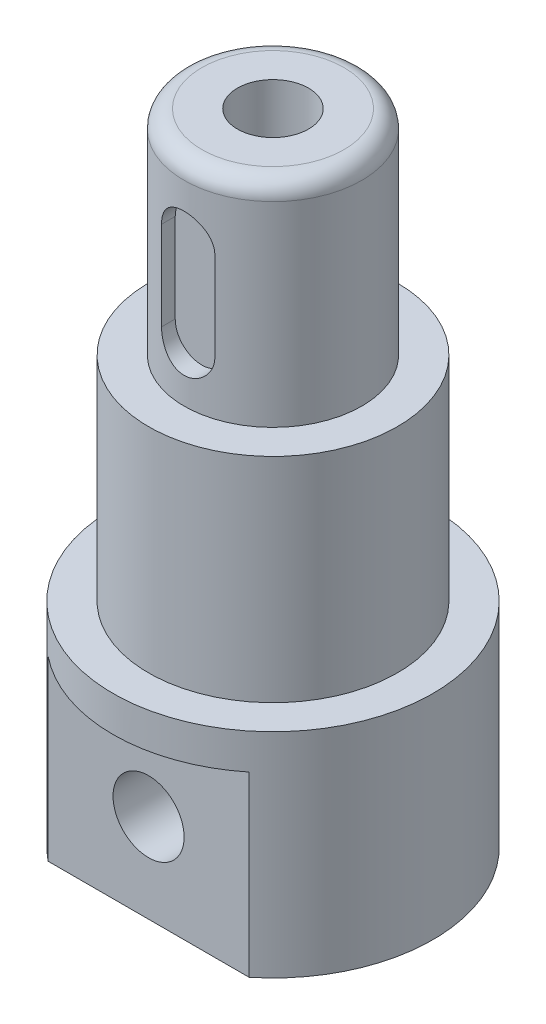
from build123d import *

# Parameters (mm, degrees)
CUT_EXTRUDE2_DEPTH      = 45.09081537
CUT_EXTRUDE2_DEPTH_BACK = 45.09081537
SKETCH2_R               = 4
CUT_EXTRUDE3_START      = -14
SKETCH2_4_W             = 30
SKETCH2_4_H             = 25.460379871
SKETCH2_4_R             = 4
CUT_EXTRUDE3_DEPTH      = 31.090815533
CUT_EXTRUDE4_START      = 14
SKETCH2_5_W             = 30
SKETCH2_5_H             = 25.460379871
SKETCH2_5_R             = 4
CUT_EXTRUDE4_DEPTH      = 31.090815533
CUT_EXTRUDE5_START      = -8
CUT_EXTRUDE5_DEPTH      = 10
CUT_EXTRUDE6_START      = 18
CUT_EXTRUDE6_DEPTH      = 10


with BuildPart() as part:
    # Sketch1 → Revolve1 (revolve)
    with BuildSketch(Plane.XY):
        with BuildLine():
            Line((18, -36), (18, -12))
            Line((18, -12), (14, -12))
            Line((14, -12), (14, 12))
            Line((14, 12), (10, 12))
            Line((10, 12), (10, 34))
            ThreePointArc((10, 34), (9.414213562, 35.414213562), (8, 36))
            Line((8, 36), (4, 36))
            Line((4, 36), (4, -36))
            Line((4, -36), (18, -36))
        make_face()
    revolve(axis=Axis((0, -36, 0), (0, 1, 0)))

    # Sketch2 → Cut-Extrude2 (cut, two sides: drawn at the far end of the back side and taken through both)
    with BuildSketch(Plane.XY.offset(-CUT_EXTRUDE2_DEPTH_BACK)):
        with Locations((0, -26)):
            Circle(SKETCH2_R)
    extrude(amount=CUT_EXTRUDE2_DEPTH + CUT_EXTRUDE2_DEPTH_BACK, mode=Mode.SUBTRACT)

    # Sketch2<4> → Cut-Extrude3 (cut, through all)
    with BuildSketch(Plane.XY.offset(CUT_EXTRUDE3_START)):
        with Locations((0, -28.730189936)):
            Rectangle(SKETCH2_4_W, SKETCH2_4_H)
        with Locations((0, -26)):
            Circle(SKETCH2_4_R, mode=Mode.SUBTRACT)
    extrude(amount=-CUT_EXTRUDE3_DEPTH, mode=Mode.SUBTRACT)

    # Sketch2<5> → Cut-Extrude4 (cut, through all)
    with BuildSketch(Plane.XY.offset(CUT_EXTRUDE4_START)):
        with Locations((0, -28.730189936)):
            Rectangle(SKETCH2_5_W, SKETCH2_5_H)
        with Locations((0, -26)):
            Circle(SKETCH2_5_R, mode=Mode.SUBTRACT)
    extrude(amount=CUT_EXTRUDE4_DEPTH, mode=Mode.SUBTRACT)

    # Sketch4 → Cut-Extrude5 (cut)
    with BuildSketch(Plane.XY.offset(CUT_EXTRUDE5_START)):
        with BuildLine():
            Line((3, 28), (3, 18))
            ThreePointArc((3, 18), (0, 15), (-3, 18))
            Line((-3, 18), (-3, 28))
            ThreePointArc((-3, 28), (0, 31), (3, 28))
        make_face()
    extrude(amount=-CUT_EXTRUDE5_DEPTH, mode=Mode.SUBTRACT)

    # Sketch4<2> → Cut-Extrude6 (cut)
    with BuildSketch(Plane.XY.offset(CUT_EXTRUDE6_START)):
        with BuildLine():
            Line((3, 28), (3, 18))
            ThreePointArc((3, 18), (0, 15), (-3, 18))
            Line((-3, 18), (-3, 28))
            ThreePointArc((-3, 28), (0, 31), (3, 28))
        make_face()
    extrude(amount=-CUT_EXTRUDE6_DEPTH, mode=Mode.SUBTRACT)


solid = part.part
